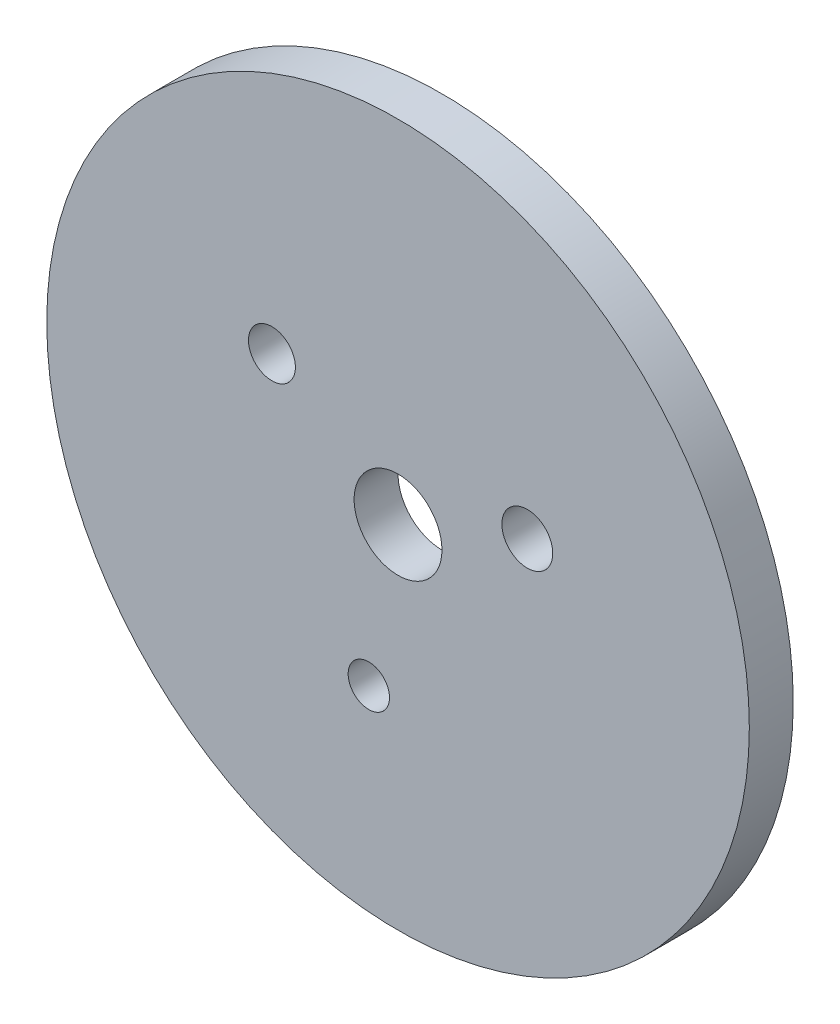
from build123d import *

# Parameters (mm, degrees)
SKETCH1_R           = 25.4
SKETCH1_R_2         = 3.175
BOSS_EXTRUDE1_DEPTH = 3.175
ATTACHMENTHOLES_R   = 1.697640298
ATTACHMENTHOLES_R_2 = 1.839394333
ATTACHMENTHOLES_R_3 = 1.494089935
CUT_EXTRUDE1_DEPTH  = 37.061067996


with BuildPart() as part:
    # Sketch1 → Boss-Extrude1 (new body)
    with BuildSketch(Plane.XY):
        Circle(SKETCH1_R)
        Circle(SKETCH1_R_2, mode=Mode.SUBTRACT)
    extrude(amount=BOSS_EXTRUDE1_DEPTH)

    # AttachmentHoles → Cut-Extrude1 (cut, through all)
    with BuildSketch(Plane.XY):
        with Locations((-9.118891252, 6.145879466)):
            Circle(ATTACHMENTHOLES_R)
        with Locations((9.347171253, 3.791989153)):
            Circle(ATTACHMENTHOLES_R_2)
        with Locations((-2.113411396, -11.140283228)):
            Circle(ATTACHMENTHOLES_R_3)
    extrude(amount=CUT_EXTRUDE1_DEPTH, mode=Mode.SUBTRACT)


solid = part.part
